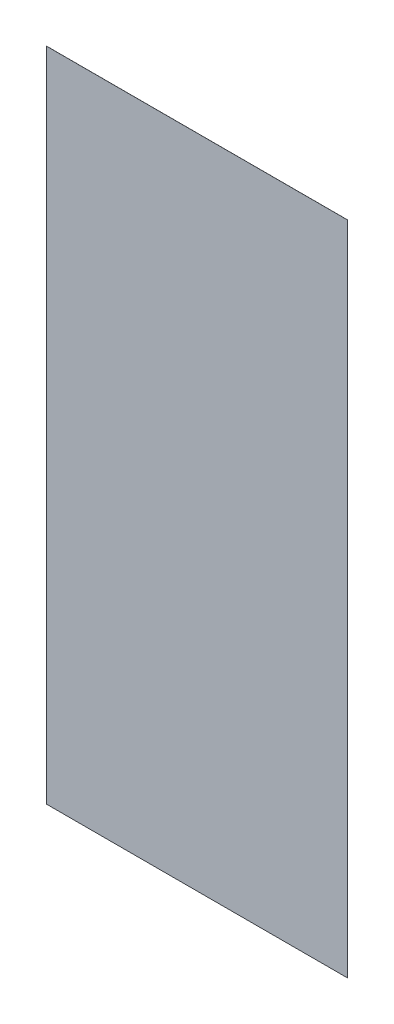
from build123d import *

# Parameters (mm, degrees)
SKETCH1_W           = 120.65
SKETCH1_H           = 262.89
BOSS_EXTRUDE1_DEPTH = 0.0254


with BuildPart() as part:
    # Sketch1 → Boss-Extrude1 (new body)
    with BuildSketch(Plane.XY):
        with Locations((60.325, 131.445)):
            Rectangle(SKETCH1_W, SKETCH1_H)
    extrude(amount=BOSS_EXTRUDE1_DEPTH)


solid = part.part
